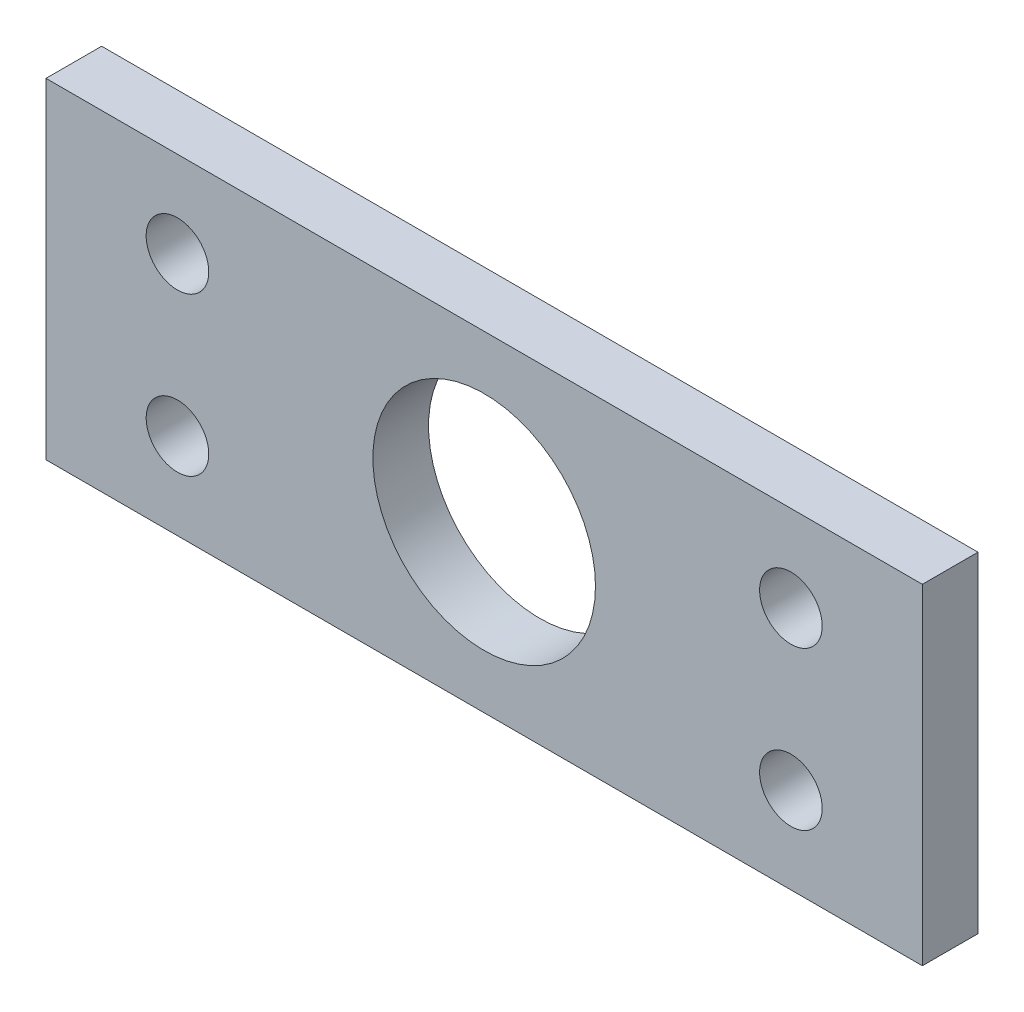
from build123d import *

# Parameters (mm, degrees)
CROQUIS1_W              = 200
CROQUIS1_H              = 75.4
CROQUIS1_R              = 25.4
SALIENTE_EXTRUIR1_DEPTH = 12.7
CROQUIS2_R              = 7.14375
CORTAR_EXTRUIR1_DEPTH   = 15


with BuildPart() as part:
    # Croquis1 → Saliente-Extruir1 (new body)
    with BuildSketch(Plane.XY):
        with Locations((0, -12.3)):
            Rectangle(CROQUIS1_W, CROQUIS1_H)
        with Locations((0, -12.3)):
            Circle(CROQUIS1_R, mode=Mode.SUBTRACT)
    extrude(amount=SALIENTE_EXTRUIR1_DEPTH)

    # Croquis2 → Cortar-Extruir1 (cut)
    with BuildSketch(Plane.XY.offset(12.7)):
        with Locations((-70, 5.7)):
            Circle(CROQUIS2_R)
        with Locations((-70, -30.3)):
            Circle(CROQUIS2_R)
        with Locations((70, -30.3)):
            Circle(CROQUIS2_R)
        with Locations((70, 5.7)):
            Circle(CROQUIS2_R)
    extrude(amount=-CORTAR_EXTRUIR1_DEPTH, mode=Mode.SUBTRACT)


solid = part.part
